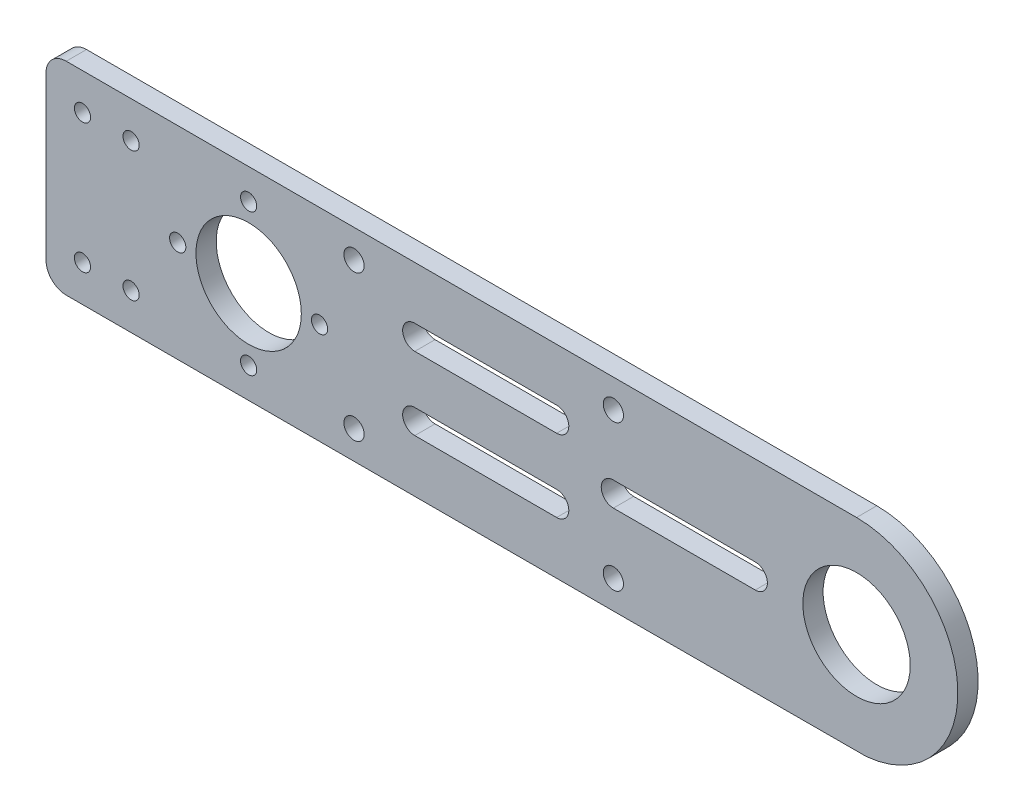
from build123d import *

# Parameters (mm, degrees)
SKETCH_1_R      = 13.25
SKETCH_1_R_2    = 2
SKETCH_1_R_3    = 2.5
SKETCH_1_R_4    = 13
EXTRUDE_1_DEPTH = 5
FILLET_1_R      = 5


with BuildPart() as part:
    # 草图1 → 凸台-拉伸1 (new body)
    with BuildSketch(Plane.XY):
        with BuildLine():
            Line((0, 25), (124.869292101, 25))
            Line((124.869292101, 25), (184, 25))
            ThreePointArc((184, 25), (208.968890762, 1.246793543), (186.490484142, -24.875640469))
            Line((186.490484142, -24.875640469), (124.869292101, -25))
            Line((124.869292101, -25), (0, -25))
            Line((0, -25), (-16, -25))
            Line((-16, -25), (-16, 25))
            Line((-16, 25), (0, 25))
        make_face()
        with Locations((184, 0)):
            Circle(SKETCH_1_R, mode=Mode.SUBTRACT)
        with Locations((5, 16)):
            Circle(SKETCH_1_R_2, mode=Mode.SUBTRACT)
        with Locations(Location((5, -16, 0), (0, 0, 180))):
            Circle(SKETCH_1_R_2, mode=Mode.SUBTRACT)
        with Locations((60, 18)):
            Circle(SKETCH_1_R_3, mode=Mode.SUBTRACT)
        with Locations((124, 18)):
            Circle(SKETCH_1_R_3, mode=Mode.SUBTRACT)
        with Locations((34, 0)):
            Circle(SKETCH_1_R_4, mode=Mode.SUBTRACT)
        with Locations((34, 17.5)):
            Circle(SKETCH_1_R_2, mode=Mode.SUBTRACT)
        with Locations(Location((124, -18, 0), (0, 0, 180))):
            Circle(SKETCH_1_R_3, mode=Mode.SUBTRACT)
        with Locations(Location((60, -18, 0), (0, 0, 180))):
            Circle(SKETCH_1_R_3, mode=Mode.SUBTRACT)
        with Locations((51.5, 0)):
            Circle(SKETCH_1_R_2, mode=Mode.SUBTRACT)
        with Locations((34, -17.5)):
            Circle(SKETCH_1_R_2, mode=Mode.SUBTRACT)
        with Locations((16.5, 0)):
            Circle(SKETCH_1_R_2, mode=Mode.SUBTRACT)
        with Locations((-7, 16)):
            Circle(SKETCH_1_R_2, mode=Mode.SUBTRACT)
        with Locations(Location((-7, -16, 0), (0, 0, 180))):
            Circle(SKETCH_1_R_2, mode=Mode.SUBTRACT)
        with BuildLine():
            Line((75, -12), (110, -12))
            ThreePointArc((110, -12), (113, -9), (110, -6))
            Line((110, -6), (75, -6))
            ThreePointArc((75, -6), (72, -9), (75, -12))
        make_face(mode=Mode.SUBTRACT)
        with BuildLine():
            Line((124, 3), (159, 3))
            ThreePointArc((159, 3), (162, 0), (159, -3))
            Line((159, -3), (124, -3))
            ThreePointArc((124, -3), (121, 0), (124, 3))
        make_face(mode=Mode.SUBTRACT)
        with BuildLine():
            Line((75, 12), (110, 12))
            ThreePointArc((110, 12), (113, 9), (110, 6))
            Line((110, 6), (75, 6))
            ThreePointArc((75, 6), (72, 9), (75, 12))
        make_face(mode=Mode.SUBTRACT)
    extrude(amount=EXTRUDE_1_DEPTH)

    # 圆角1
    fillet_1_edges = [part.edges().sort_by_distance(p)[0] for p in [
        (-16, -25, 2.5),
        (-16, 25, 2.5),
    ]]
    fillet(fillet_1_edges, radius=FILLET_1_R)


solid = part.part
